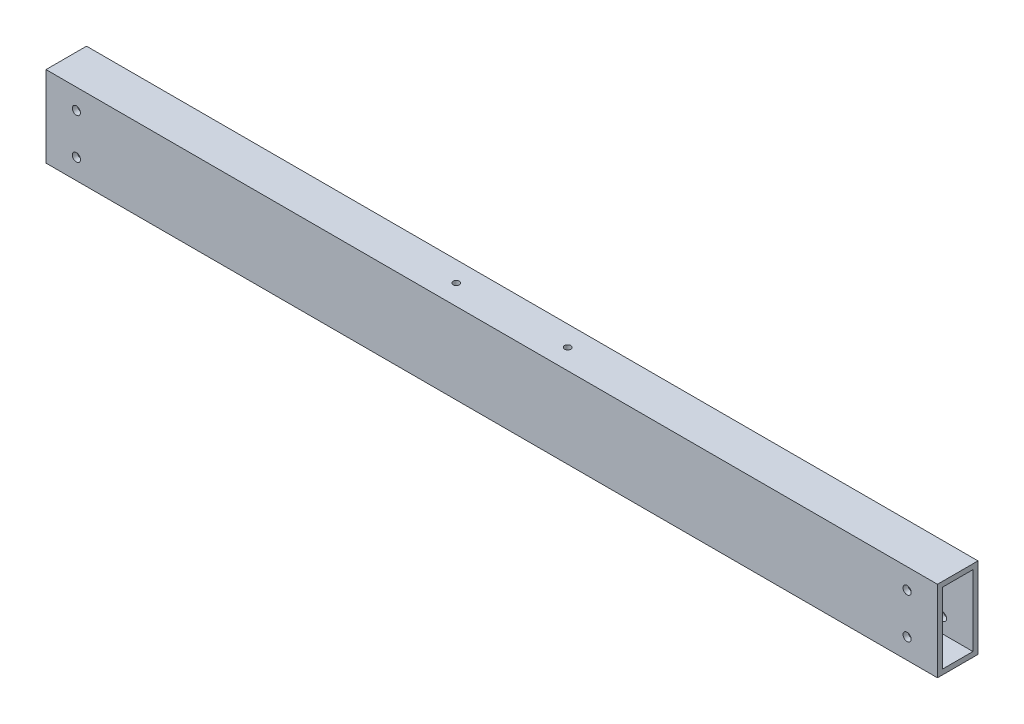
from build123d import *

# Parameters (mm, degrees)
SKETCH1_W                           = 558.8
SKETCH1_H                           = 50.8
BOSS_EXTRUDE1_DEPTH                 = 12.7
SKETCH2_W                           = 19.05
SKETCH2_H                           = 44.45
CUT_EXTRUDE1_DEPTH                  = 560.521125607
F_1_4_20_TAPPED_HOLE1_D             = 5.1054
F_10_32_TAPPED_HOLE1_D              = 4.0386
F_10_32_TAPPED_HOLE1_DEPTH          = 5.08
F_10_32_TAPPED_HOLE1_TIP            = 1.213317848
F_5_32_0_15625_DIAMETER_HOLE1_D     = 3.96875
F_5_32_0_15625_DIAMETER_HOLE1_DEPTH = 5.08
F_5_32_0_15625_DIAMETER_HOLE1_TIP   = 1.192332791


with BuildPart() as part:
    # Sketch1 → Boss-Extrude1 (new, symmetric)
    with BuildSketch(Plane.XY):
        Rectangle(SKETCH1_W, SKETCH1_H)
    extrude(amount=BOSS_EXTRUDE1_DEPTH, both=True)

    # Sketch2 → Cut-Extrude1 (cut, through all)
    with BuildSketch(Plane(origin=(279.4, 0, 0), x_dir=(0, 0, -1), z_dir=(1, 0, 0))):
        Rectangle(SKETCH2_W, SKETCH2_H)
    extrude(amount=-CUT_EXTRUDE1_DEPTH, mode=Mode.SUBTRACT)

    # 1/4-20 Tapped Hole1 (through all)
    with Locations(Plane.XY.offset(12.7)):
        with Locations((-260.35, 12.7), (-260.35, -12.7), (260.35, 12.7), (260.35, -12.7)):
            Hole(F_1_4_20_TAPPED_HOLE1_D / 2)

    # #10-32 Tapped Hole1
    with Locations(Plane(origin=(0, 0, -12.7), x_dir=(-1, 0, 0), z_dir=(0, 0, -1))):
        with Locations((-190.5, -13.49375), (-114.3, -13.49375), (-38.1, -13.49375), (38.1, -13.49375), (114.3, -13.49375), (190.5, -13.49375)):
            Hole(F_10_32_TAPPED_HOLE1_D / 2, depth=F_10_32_TAPPED_HOLE1_DEPTH)
            with Locations((0, 0, -(F_10_32_TAPPED_HOLE1_DEPTH + F_10_32_TAPPED_HOLE1_TIP / 2))):  # 118° drill point
                Cone(0, F_10_32_TAPPED_HOLE1_D / 2, F_10_32_TAPPED_HOLE1_TIP, mode=Mode.SUBTRACT)

    # 5/32 (0.15625) Diameter Hole1
    with Locations(Plane(origin=(0, 25.4, 0), x_dir=(1, 0, 0), z_dir=(0, 1, 0))):
        with Locations((-34.925, 0), (34.925, 0)):
            Hole(F_5_32_0_15625_DIAMETER_HOLE1_D / 2, depth=F_5_32_0_15625_DIAMETER_HOLE1_DEPTH)
            with Locations((0, 0, -(F_5_32_0_15625_DIAMETER_HOLE1_DEPTH + F_5_32_0_15625_DIAMETER_HOLE1_TIP / 2))):  # 118° drill point
                Cone(0, F_5_32_0_15625_DIAMETER_HOLE1_D / 2, F_5_32_0_15625_DIAMETER_HOLE1_TIP, mode=Mode.SUBTRACT)


solid = part.part
